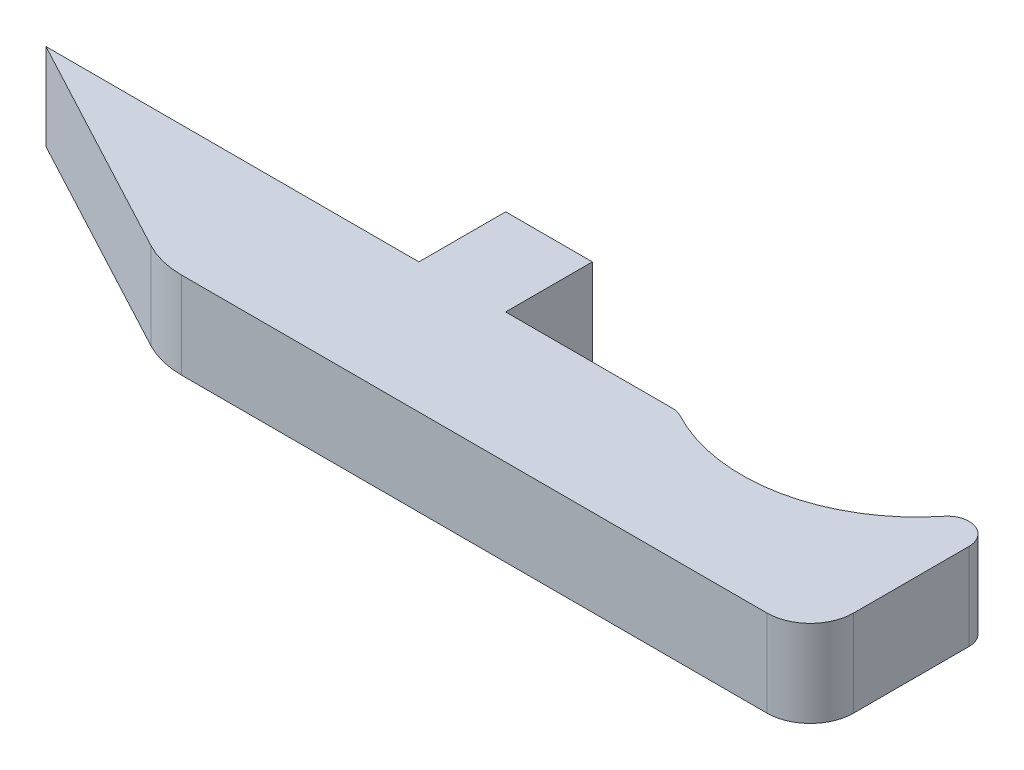
from build123d import *

# Parameters (mm, degrees)
BOSS_EXTRUDE1_DEPTH = 6.35
FILLET1_R           = 1.5875
FILLET2_R           = 6.35
FILLET3_R           = 3.175
SKETCH2_W           = 6.35
SKETCH2_H           = 6.35
BOSS_EXTRUDE2_DEPTH = 6.35


with BuildPart() as part:
    # Sketch1 → Boss-Extrude1 (new body)
    with BuildSketch(Plane(origin=(0, 0, 0), x_dir=(1, 0, 0), z_dir=(0, 1, 0))):
        with BuildLine():
            Line((52.558738922, -45.868730992), (33.5895, -45.868730992))
            Line((33.5895, -45.868730992), (6.2845, -45.868730992))
            Line((6.2845, -45.868730992), (24.145239996, -55.393730992))
            Line((24.145239996, -55.393730992), (71.770239996, -55.393730992))
            Line((71.770239996, -55.393730992), (71.770239996, -34.743530992))
            ThreePointArc((71.770239996, -34.743530992), (65.371223106, -45.84366442), (52.558738922, -45.868730992))
        make_face()
    extrude(amount=BOSS_EXTRUDE1_DEPTH)

    # Fillet1
    fillet1_edges = [part.edges().sort_by_distance(p)[0] for p in [
        (71.770239996, 3.175, 34.743530992),
        (52.558738922, 3.175, 45.868730992),
    ]]
    fillet(fillet1_edges, radius=FILLET1_R)

    # Fillet2
    fillet2_edges = [part.edges().sort_by_distance(p)[0] for p in [
        (24.145239996, 3.175, 55.393730992),
    ]]
    fillet(fillet2_edges, radius=FILLET2_R)

    # Fillet3
    fillet3_edges = [part.edges().sort_by_distance(p)[0] for p in [
        (71.770239996, 3.175, 55.393730992),
    ]]
    fillet(fillet3_edges, radius=FILLET3_R)

    # Sketch2 → Boss-Extrude2 (add)
    with BuildSketch(Plane(origin=(0, 0, 45.868730992), x_dir=(-1, 0, 0), z_dir=(0, 0, -1))):
        with Locations((-36.7645, 3.175)):
            Rectangle(SKETCH2_W, SKETCH2_H)
    extrude(amount=BOSS_EXTRUDE2_DEPTH)


solid = part.part
